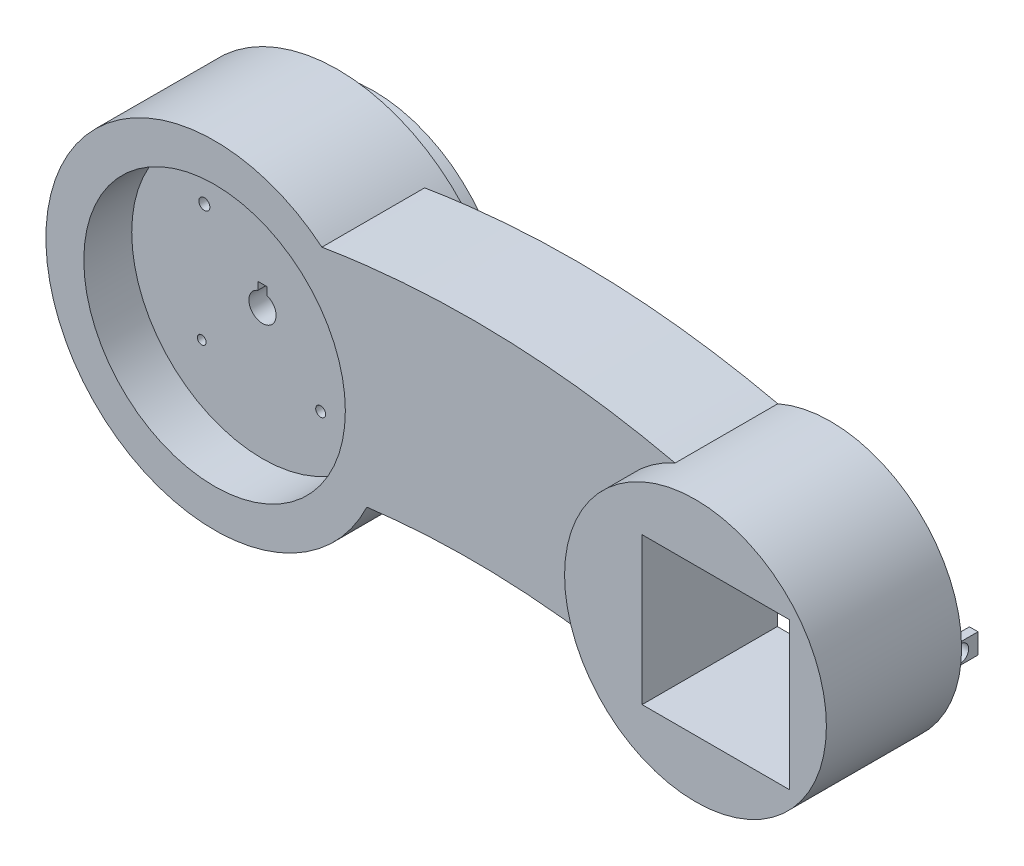
from build123d import *

# Parameters (mm, degrees)
BOSS_EXTRUDE1_DEPTH      = 60
BOSS_EXTRUDE2_DEPTH      = 33
BOSS_EXTRUDE2_DEPTH_BACK = 60
SKETCH2_R                = 77.225042667
CUT_EXTRUDE1_START       = -93
SKETCH3_W                = 86
SKETCH3_H                = 86
CUT_EXTRUDE1_DEPTH       = 93
SKETCH5_R                = 8.339423789
CUT_EXTRUDE2_DEPTH       = 32
SKETCH6_R                = 98.557692829
BOSS_EXTRUDE4_DEPTH      = 72
SKETCH7_R                = 76.411672253
CUT_EXTRUDE3_DEPTH       = 28
CUT_EXTRUDE4_DEPTH       = 83
FILLET1_R                = 10
SKETCH9_R                = 3.245091186
SKETCH9_R_2              = 2.883963725
SKETCH9_R_3              = 2.550346097
SKETCH9_R_4              = 2.891984129
CUT_EXTRUDE5_DEPTH       = 136
BOSS_EXTRUDE5_DEPTH      = 5
SKETCH11_R               = 76.496469964
BOSS_EXTRUDE6_DEPTH      = 79
SKETCH12_W               = 86
SKETCH12_H               = 86
CUT_EXTRUDE6_DEPTH       = 79
SKETCH13_W               = 4.996412745
SKETCH13_H               = 11.809702853
SKETCH13_W_2             = 4.996412746
BOSS_EXTRUDE7_DEPTH      = 24
SKETCH14_R               = 5.003367427
CUT_EXTRUDE7_DEPTH       = 110


with BuildPart() as part:
    # Sketch1 → Boss-Extrude1 (new body)
    with BuildSketch(Plane.XY):
        with BuildLine():
            ThreePointArc((0, 62), (-62, 0), (0, -62))
            add(Edge.make_bspline(
                [(0, -62), (150.279576887, -14.957493715), (300, -62)],
                knots=[0, 0, 0, 1, 1, 1], degree=2))
            ThreePointArc((300, -62), (362, 0), (300, 62))
            add(Edge.make_bspline(
                [(0, 62), (151.899859743, 104.734690873), (300, 62)],
                knots=[0, 0, 0, 1, 1, 1], degree=2))
        make_face()
    extrude(amount=BOSS_EXTRUDE1_DEPTH)

    # Sketch2 → Boss-Extrude2 (add, two sides: drawn at the far end of the back side and taken through both)
    with BuildSketch(Plane(origin=(0, 0, 0), x_dir=(-1, 0, 0), z_dir=(0, 0, -1)).offset(-BOSS_EXTRUDE2_DEPTH_BACK)):
        Circle(SKETCH2_R)
    extrude(amount=BOSS_EXTRUDE2_DEPTH + BOSS_EXTRUDE2_DEPTH_BACK)

    # Sketch3 → Cut-Extrude1 (cut)
    with BuildSketch(Plane(origin=(0, 0, -33), x_dir=(-1, 0, 0), z_dir=(0, 0, -1)).offset(CUT_EXTRUDE1_START)):
        Rectangle(SKETCH3_W, SKETCH3_H)
    extrude(amount=CUT_EXTRUDE1_DEPTH, mode=Mode.SUBTRACT)

    # Sketch5 → Cut-Extrude2 (cut)
    with BuildSketch(Plane.XY.offset(60)):
        with Locations((300, 0)):
            Circle(SKETCH5_R)
    extrude(amount=-CUT_EXTRUDE2_DEPTH, mode=Mode.SUBTRACT)

    # Sketch6 → Boss-Extrude4 (add)
    with BuildSketch(Plane.XY.offset(60)):
        Circle(SKETCH6_R)
    extrude(amount=-BOSS_EXTRUDE4_DEPTH)

    # Sketch7 → Cut-Extrude3 (cut)
    with BuildSketch(Plane.XY.offset(60)):
        Circle(SKETCH7_R)
    extrude(amount=-CUT_EXTRUDE3_DEPTH, mode=Mode.SUBTRACT)

    # Sketch8 → Cut-Extrude4 (cut)
    with BuildSketch(Plane.XY.offset(32)):
        with BuildLine():
            Line((-2.718688397, 7.460049156), (-2.718688397, 12.013366186))
            Line((-2.718688397, 12.013366186), (2.718688397, 12.013366186))
            Line((2.718688397, 12.013366186), (2.718688397, 7.460049156))
            ThreePointArc((2.718688397, 7.460049156), (0, -7.94), (-2.718688397, 7.460049156))
        make_face()
    extrude(amount=-CUT_EXTRUDE4_DEPTH, mode=Mode.SUBTRACT)

    # Fillet1
    fillet1_edges = [part.edges().sort_by_distance(p)[0] for p in [
        (77.225042667, 0, -12),
    ]]
    fillet(fillet1_edges, radius=FILLET1_R)

    # Sketch9 → Cut-Extrude5 (cut)
    with BuildSketch(Plane.XY.offset(32)):
        with Locations((-33.983078495, 35.500357407)):
            Circle(SKETCH9_R)
        with Locations((35.500357407, 33.983078495)):
            Circle(SKETCH9_R_2)
        with Locations((-35.500357407, -33.983078495)):
            Circle(SKETCH9_R_3)
        with Locations((33.983078495, -35.500357407)):
            Circle(SKETCH9_R_4)
    extrude(amount=-CUT_EXTRUDE5_DEPTH, mode=Mode.SUBTRACT)

    # Sketch10 → Boss-Extrude5 (add)
    # profile 1 of 4: a face of its own
    with BuildSketch(Plane(origin=(0, 0, 0), x_dir=(-1, 0, 0), z_dir=(0, 0, -1))):
        Polygon((-261.707671172, 45.835785702), (-258.145972454, 45.835785702), (-258.145972454, 30.722416812), (-241.6015639, 45.835785702), (-236.521373095, 45.835785702), (-256.02326362, 28.027292113), (-234.994930787, 6.148285702), (-239.741212338, 6.148285702), (-258.145972454, 25.300366532), (-258.145972454, 6.148285702), (-261.707671172, 6.148285702), align=None)
    # profile 2 of 4: a face of its own
    with BuildSketch(Plane(origin=(0, 0, 0), x_dir=(-1, 0, 0), z_dir=(0, 0, -1))):
        Polygon((-212.861517326, 45.835785702), (-194.544209633, 6.148285702), (-198.415966945, 6.148285702), (-204.283229565, 18.868638267), (-222.274578223, 18.868638267), (-228.308795471, 6.148285702), (-232.196453223, 6.148285702), (-213.370331428, 45.835785702), align=None)
        Polygon((-213.155675479, 38.100221299), (-220.342674677, 22.939151087), (-206.159481568, 22.939151087), align=None, mode=Mode.SUBTRACT)
    # profile 3 of 4: a face of its own
    with BuildSketch(Plane(origin=(0, 0, 0), x_dir=(-1, 0, 0), z_dir=(0, 0, -1))):
        with BuildLine():
            Line((-187.420812197, 45.835785702), (-179.677297574, 45.835785702))
            add(Edge.make_bspline(
                [(-179.677297574, 45.835785702), (-179.298242509, 45.833792818), (-178.563539454, 45.829930113), (-177.495158283, 45.77002318), (-176.494479806, 45.688338709), (-175.561213816, 45.558729622), (-174.695791565, 45.402340721), (-173.895604964, 45.212954056), (-173.163198547, 44.985866562), (-172.288795196, 44.62475248), (-171.291837703, 44.088141554), (-170.212355928, 43.295201574), (-169.28929, 42.325324537), (-168.493427295, 41.23128014), (-167.860682457, 40.0277763), (-167.40292346, 38.743497998), (-167.11311541, 37.395010389), (-167.083310843, 36.469235069), (-167.068248095, 36.001363126)],
                knots=[0, 0, 0, 0, 1.001505555, 1.941167018, 2.826882275, 3.653841531, 4.429895133, 5.150066043, 5.825578002, 6.45369114, 7.647487171, 8.808567382, 9.977351308, 11.170798116, 12.373658725, 13.556498008, 14.765093433, 16, 16, 16, 16], degree=3))
            add(Edge.make_bspline(
                [(-167.068248095, 36.001363126), (-167.080644411, 35.563070754), (-167.105004342, 34.701784909), (-167.337944559, 33.442057063), (-167.702623567, 32.242913778), (-168.20954916, 31.108731372), (-168.868384296, 30.065135937), (-169.649188445, 29.103708902), (-170.591220045, 28.265156738), (-171.297013927, 27.796357754), (-171.655525238, 27.558229112)],
                knots=[0, 0, 0, 0, 1.044552857, 2.05264487, 3.044412934, 4.028983338, 5.005914585, 5.980388656, 6.974128949, 8, 8, 8, 8], degree=3))
            add(Edge.make_bspline(
                [(-171.655525238, 27.558229112), (-171.20467039, 27.385134927), (-170.342073379, 27.053962874), (-169.155008774, 26.468453595), (-168.132263657, 25.831615379), (-167.265974591, 25.136156007), (-166.525092254, 24.386529313), (-165.878152648, 23.571743642), (-165.326140638, 22.681170227), (-164.853145879, 21.724094424), (-164.484066235, 20.710288935), (-164.207660891, 19.64926317), (-164.049279994, 18.544821785), (-164.026741562, 17.79319293), (-164.015363479, 17.413747942)],
                knots=[0, 0, 0, 0, 1.27268992, 2.434971085, 3.483601985, 4.442670788, 5.356604649, 6.2567628, 7.179492994, 8.113709626, 9.066344395, 10.018646069, 10.999752585, 12, 12, 12, 12], degree=3))
            add(Edge.make_bspline(
                [(-164.015363479, 17.413747942), (-164.026440216, 17.026320017), (-164.048234004, 16.264044721), (-164.209024756, 15.144232034), (-164.48127088, 14.07408755), (-164.856274057, 13.046689496), (-165.345703875, 12.064025472), (-165.94133347, 11.12498221), (-166.651530665, 10.238994711), (-167.445993554, 9.396217914), (-168.344769668, 8.638438539), (-169.314457246, 7.963572937), (-170.367268195, 7.408559554), (-171.485911341, 6.942333239), (-172.682935283, 6.586198042), (-173.952964849, 6.337044749), (-175.2949047, 6.169166204), (-176.21576527, 6.15536397), (-176.688014721, 6.148285702)],
                knots=[0, 0, 0, 0, 0.978564426, 1.925352924, 2.850884081, 3.763762016, 4.682927383, 5.618979971, 6.567305752, 7.547517671, 8.540179244, 9.531824382, 10.526200242, 11.540722885, 12.589160233, 13.674978461, 14.80764778, 16, 16, 16, 16], degree=3))
            Line((-176.688014721, 6.148285702), (-187.420812197, 6.148285702))
            Line((-187.420812197, 6.148285702), (-187.420812197, 45.835785702))
        make_face()
        with BuildLine():
            Line((-183.859113479, 41.765272882), (-183.859113479, 29.044920318))
            Line((-183.859113479, 29.044920318), (-181.466097153, 29.044920318))
            add(Edge.make_bspline(
                [(-181.466097153, 29.044920318), (-181.116293849, 29.049455159), (-180.440402579, 29.058217396), (-179.461596609, 29.083317099), (-178.553036135, 29.153598484), (-177.716289456, 29.22385967), (-176.952674243, 29.338098298), (-176.263882242, 29.474080406), (-175.639103509, 29.61789549), (-174.918610448, 29.862478065), (-174.101354693, 30.223948132), (-173.230122173, 30.784923416), (-172.46206167, 31.453083493), (-171.813486416, 32.224052434), (-171.282677777, 33.072981506), (-170.913995471, 33.986325597), (-170.663995017, 34.941321737), (-170.641412473, 35.596939425), (-170.629946813, 35.929811143)],
                knots=[0, 0, 0, 0, 1.156816544, 2.235205308, 3.236616184, 4.169592532, 5.011045266, 5.787822928, 6.49130361, 7.128639758, 8.301311294, 9.436451833, 10.541879658, 11.654887649, 12.756523258, 13.837046038, 14.901820046, 16, 16, 16, 16], degree=3))
            add(Edge.make_bspline(
                [(-170.629946813, 35.929811143), (-170.63591332, 36.150085517), (-170.647617276, 36.582177754), (-170.74347169, 37.212067752), (-170.906389721, 37.804474588), (-171.115648225, 38.367516732), (-171.408073534, 38.883588605), (-171.75237352, 39.370533771), (-172.168363044, 39.8117694), (-172.641861143, 40.224173533), (-173.186244634, 40.589803446), (-173.801188747, 40.910033529), (-174.495013299, 41.167897693), (-175.256025137, 41.393732636), (-176.095938361, 41.552349896), (-177.005060529, 41.684490988), (-177.990838147, 41.751764045), (-178.672840649, 41.760669499), (-179.025379505, 41.765272882)],
                knots=[0, 0, 0, 0, 0.91205012, 1.789085906, 2.630437955, 3.453916878, 4.269457761, 5.079663411, 5.91843418, 6.774407191, 7.675494373, 8.627863946, 9.638891023, 10.736472738, 11.911756761, 13.175263542, 14.539845004, 16, 16, 16, 16], degree=3))
            Line((-179.025379505, 41.765272882), (-183.859113479, 41.765272882))
        make_face(mode=Mode.SUBTRACT)
        with BuildLine():
            Line((-183.859113479, 24.974407497), (-183.859113479, 10.218798523))
            Line((-183.859113479, 10.218798523), (-178.786872895, 10.218798523))
            add(Edge.make_bspline(
                [(-178.786872895, 10.218798523), (-178.423801145, 10.223149944), (-177.724028213, 10.231536735), (-176.713683907, 10.258916059), (-175.777250498, 10.321194543), (-174.919001102, 10.419232302), (-174.129668291, 10.525577217), (-173.418721123, 10.668580135), (-172.780396518, 10.832421026), (-172.040232493, 11.085674587), (-171.206755212, 11.479107784), (-170.308560679, 12.072313744), (-169.50997767, 12.779015537), (-168.831828749, 13.596928582), (-168.276056468, 14.486283807), (-167.871749075, 15.429092686), (-167.622388468, 16.409776791), (-167.59220137, 17.078417193), (-167.577062197, 17.413747942)],
                knots=[0, 0, 0, 0, 1.160039823, 2.235823828, 3.228722157, 4.157150951, 4.99529583, 5.772374946, 6.472645482, 7.099169577, 8.269452708, 9.405989375, 10.527446681, 11.663510218, 12.788923519, 13.866172445, 14.929861265, 16, 16, 16, 16], degree=3))
            add(Edge.make_bspline(
                [(-167.577062197, 17.413747942), (-167.580193023, 17.623449214), (-167.586404175, 18.039469257), (-167.680073648, 18.650836136), (-167.81630235, 19.243040235), (-167.992417716, 19.817689614), (-168.248906316, 20.364394863), (-168.548337675, 20.893968529), (-168.899417854, 21.407110662), (-169.446472235, 22.05585675), (-170.242172417, 22.803308593), (-171.372776031, 23.535117771), (-172.65833691, 24.125302726), (-173.590737945, 24.375895002), (-174.072392225, 24.505344497)],
                knots=[0, 0, 0, 0, 0.723448775, 1.435228256, 2.130040452, 2.821711965, 3.505591119, 4.210454504, 4.921174351, 5.648778258, 7.137944449, 8.670945889, 10.280296675, 12, 12, 12, 12], degree=3))
            add(Edge.make_bspline(
                [(-174.072392225, 24.505344497), (-174.265490009, 24.544522681), (-174.684165833, 24.629469065), (-175.366876789, 24.719136773), (-176.146292446, 24.79902272), (-177.024212571, 24.858113526), (-178.001747913, 24.919193082), (-179.080986187, 24.942946857), (-180.257520023, 24.971286682), (-181.073862103, 24.973340614), (-181.497898035, 24.974407497)],
                knots=[0, 0, 0, 0, 0.634451884, 1.375622551, 2.216452059, 3.157844607, 4.20941857, 5.370758133, 6.634282058, 8, 8, 8, 8], degree=3))
            Line((-181.497898035, 24.974407497), (-183.859113479, 24.974407497))
        make_face(mode=Mode.SUBTRACT)
    # profile 4 of 4: a face of its own
    with BuildSketch(Plane(origin=(0, 0, 0), x_dir=(-1, 0, 0), z_dir=(0, 0, -1))):
        Polygon((-139.592286556, 45.835785702), (-121.274978864, 6.148285702), (-125.146736176, 6.148285702), (-131.013998796, 18.868638267), (-149.005347454, 18.868638267), (-155.039564701, 6.148285702), (-158.927222454, 6.148285702), (-140.101100659, 45.835785702), align=None)
        Polygon((-139.886444709, 38.100221299), (-147.073443908, 22.939151087), (-132.890250799, 22.939151087), align=None, mode=Mode.SUBTRACT)
    extrude(amount=BOSS_EXTRUDE5_DEPTH)

    # Sketch11 → Boss-Extrude6 (add)
    with BuildSketch(Plane(origin=(0, 0, 0), x_dir=(-1, 0, 0), z_dir=(0, 0, -1))):
        with Locations((-300, 0)):
            Circle(SKETCH11_R)
    extrude(amount=-BOSS_EXTRUDE6_DEPTH)

    # Sketch12 → Cut-Extrude6 (cut)
    with BuildSketch(Plane(origin=(0, 0, 0), x_dir=(-1, 0, 0), z_dir=(0, 0, -1))):
        with Locations((-311.811045565, 0.090824077)):
            Rectangle(SKETCH12_W, SKETCH12_H)
    extrude(amount=-CUT_EXTRUDE6_DEPTH, mode=Mode.SUBTRACT)

    # Sketch13 → Boss-Extrude7 (add)
    with BuildSketch(Plane(origin=(0, 0, 0), x_dir=(-1, 0, 0), z_dir=(0, 0, -1))):
        with Locations((-264.04471964, -16.812414442)):
            Rectangle(SKETCH13_W, SKETCH13_H)
        with Locations((-359.57737149, -16.812414442)):
            Rectangle(SKETCH13_W_2, SKETCH13_H)
    extrude(amount=BOSS_EXTRUDE7_DEPTH)

    # Sketch14 → Cut-Extrude7 (cut)
    with BuildSketch(Plane(origin=(362.075577863, 0, 0), x_dir=(0, 0, -1), z_dir=(1, 0, 0))):
        with Locations((13.529027141, -16.812414443)):
            Circle(SKETCH14_R)
    extrude(amount=-CUT_EXTRUDE7_DEPTH, mode=Mode.SUBTRACT)


solid = part.part
